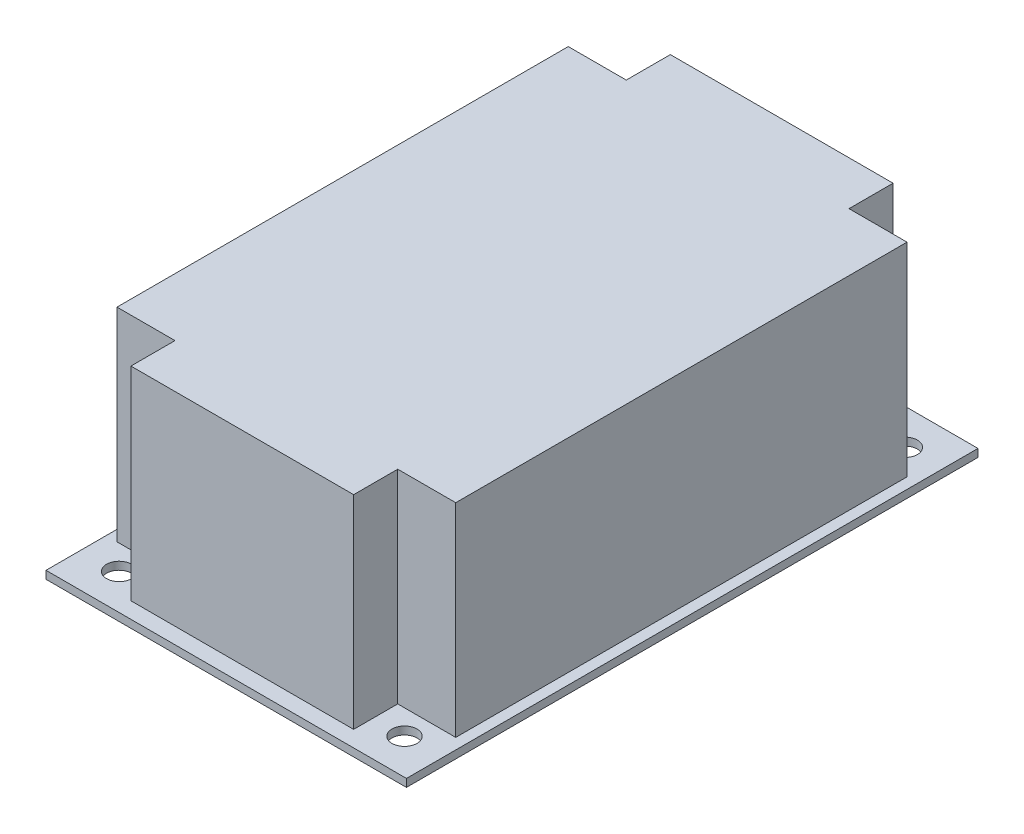
from build123d import *

# Parameters (mm, degrees)
SKETCH1_W           = 46.1
SKETCH1_H           = 73.1
BOSS_EXTRUDE1_DEPTH = 1
SKETCH3_R           = 1.6
CUT_EXTRUDE1_DEPTH  = 44.222737072
SKETCH2_W           = 7.418491492
SKETCH2_H           = 57.715863808
SKETCH2_W_2         = 28.48700733
SKETCH2_H_2         = 5.638053534
BOSS_EXTRUDE2_DEPTH = 26


with BuildPart() as part:
    # Sketch1 → Boss-Extrude1 (new body)
    with BuildSketch(Plane(origin=(0, 0, 0), x_dir=(1, 0, 0), z_dir=(0, 1, 0))):
        Rectangle(SKETCH1_W, SKETCH1_H)
    extrude(amount=BOSS_EXTRUDE1_DEPTH)

    # Sketch3 → Cut-Extrude1 (cut, through all)
    with BuildSketch(Plane(origin=(0, 1, 0), x_dir=(1, 0, 0), z_dir=(0, 1, 0))):
        with Locations(Location((-18.25, 32, 0), (0, 0, 270))):
            Circle(SKETCH3_R)
        with Locations(Location((18.25, 32, 0), (0, 0, 270))):
            Circle(SKETCH3_R)
        with Locations(Location((18.25, -32, 0), (0, 0, 270))):
            Circle(SKETCH3_R)
        with Locations(Location((-18.25, -32, 0), (0, 0, 270))):
            Circle(SKETCH3_R)
    extrude(amount=-CUT_EXTRUDE1_DEPTH, mode=Mode.SUBTRACT)

    # Sketch2 → Boss-Extrude2 (add)
    with BuildSketch(Plane(origin=(0, 1, 0), x_dir=(1, 0, 0), z_dir=(0, 1, 0))):
        with Locations((-17.952749411, 0)):
            Rectangle(SKETCH2_W, SKETCH2_H)
        Rectangle(SKETCH2_W_2, SKETCH2_H)
        with Locations((0, 31.676958671)):
            Rectangle(SKETCH2_W_2, SKETCH2_H_2)
        with Locations((17.952749411, 0)):
            Rectangle(SKETCH2_W, SKETCH2_H)
        with Locations((0, -31.676958671)):
            Rectangle(SKETCH2_W_2, SKETCH2_H_2)
    extrude(amount=BOSS_EXTRUDE2_DEPTH)


solid = part.part
